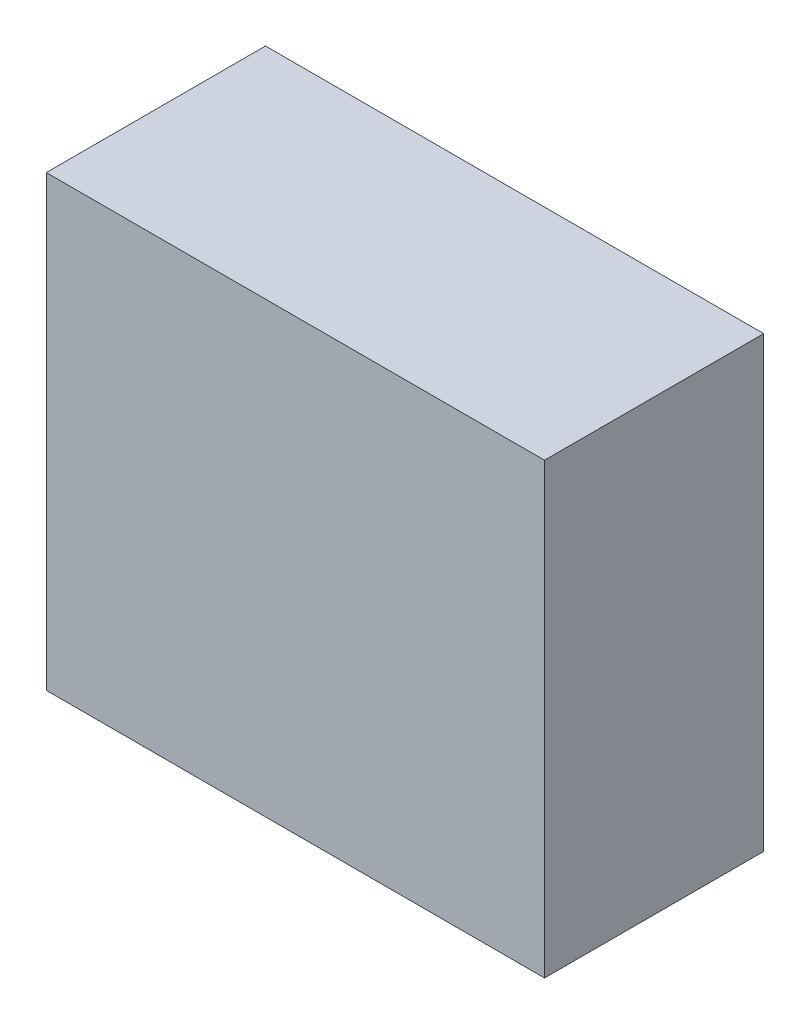
from build123d import *

# Parameters (mm, degrees)
SKETCH1_W     = 100
SKETCH1_H     = 90
PROFILE_DEPTH = 44


with BuildPart() as part:
    # Sketch1 → Profile (new body)
    with BuildSketch(Plane.XY):
        with Locations((50, 45)):
            Rectangle(SKETCH1_W, SKETCH1_H)
    extrude(amount=PROFILE_DEPTH)


solid = part.part
